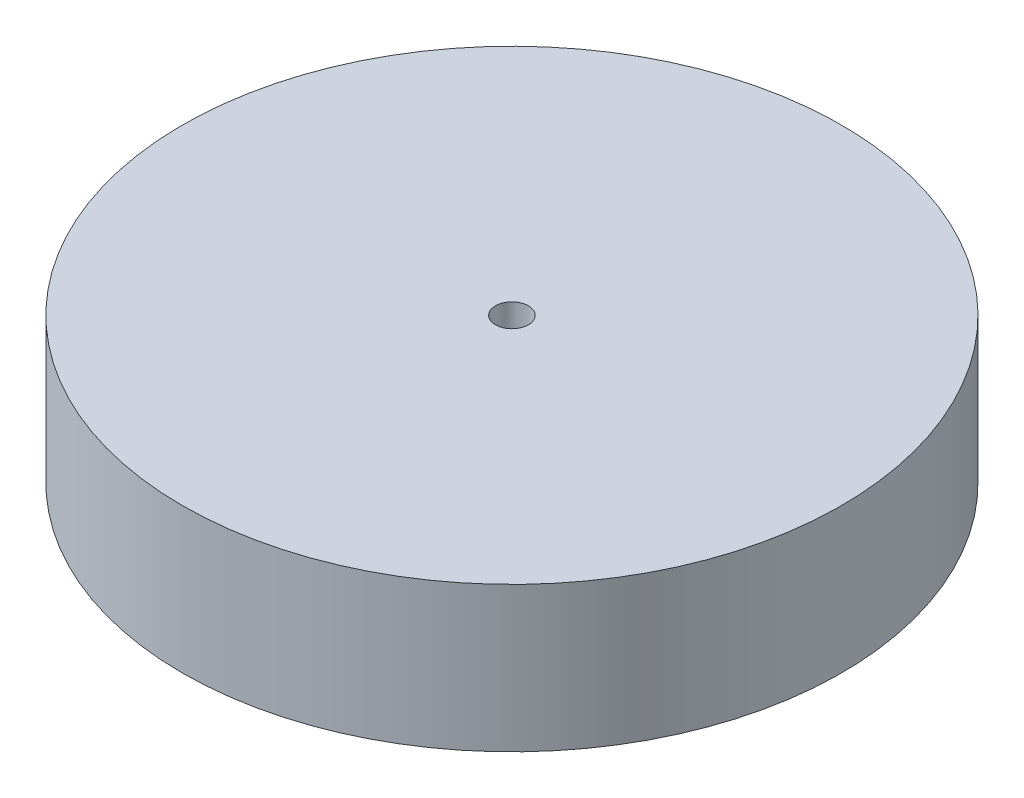
from build123d import *
from build123d.topology import SkipClean

# Parameters (mm, degrees)
ESQUISSE1_R             = 50
BOSS_EXTRU_1_DEPTH      = 22
ESQUISSE4_R             = 2.5
ENL_V_MAT_EXTRU_1_DEPTH = 7
ENL_V_START             = -15
ENL_V_MAT_EXTRU_2_DEPTH = 15


with BuildPart() as part:
    # Esquisse1 → Boss.-Extru.1 (new body)
    with BuildSketch(Plane(origin=(0, 0, 0), x_dir=(1, 0, 0), z_dir=(0, 1, 0))):
        with Locations(Location((0, 0, 0), (0, 0, 270))):
            Circle(ESQUISSE1_R)
    extrude(amount=BOSS_EXTRU_1_DEPTH)

    # Esquisse4 → Enlèv. mat.-Extru.1 (cut)
    with BuildSketch(Plane(origin=(0, 22, 0), x_dir=(1, 0, 0), z_dir=(0, 1, 0))):
        with Locations(Location((0, 0, 0), (0, 0, 270))):
            Circle(ESQUISSE4_R)
    extrude(amount=-ENL_V_MAT_EXTRU_1_DEPTH, mode=Mode.SUBTRACT)

    # Esquisse5 → Enlèv. mat.-Extru.2 (cut)
    with SkipClean():  # the faces are left unmerged after this step: merging them gives an invalid solid
        with BuildSketch(Plane(origin=(0, 0, 0), x_dir=(-1, 0, 0), z_dir=(0, -1, 0)).offset(ENL_V_START)):
            with BuildLine():
                ThreePointArc((2.5, 0), (-2.278226738, 1.02940902), (1.652253656, -1.876181723))
                Line((1.652253656, -1.876181723), (2.493901331, -0.174516908))
                ThreePointArc((2.493901331, -0.174516908), (2.498474868, -0.087311719), (2.5, 0))
            make_face()
        extrude(amount=ENL_V_MAT_EXTRU_2_DEPTH, mode=Mode.SUBTRACT)


solid = part.part
